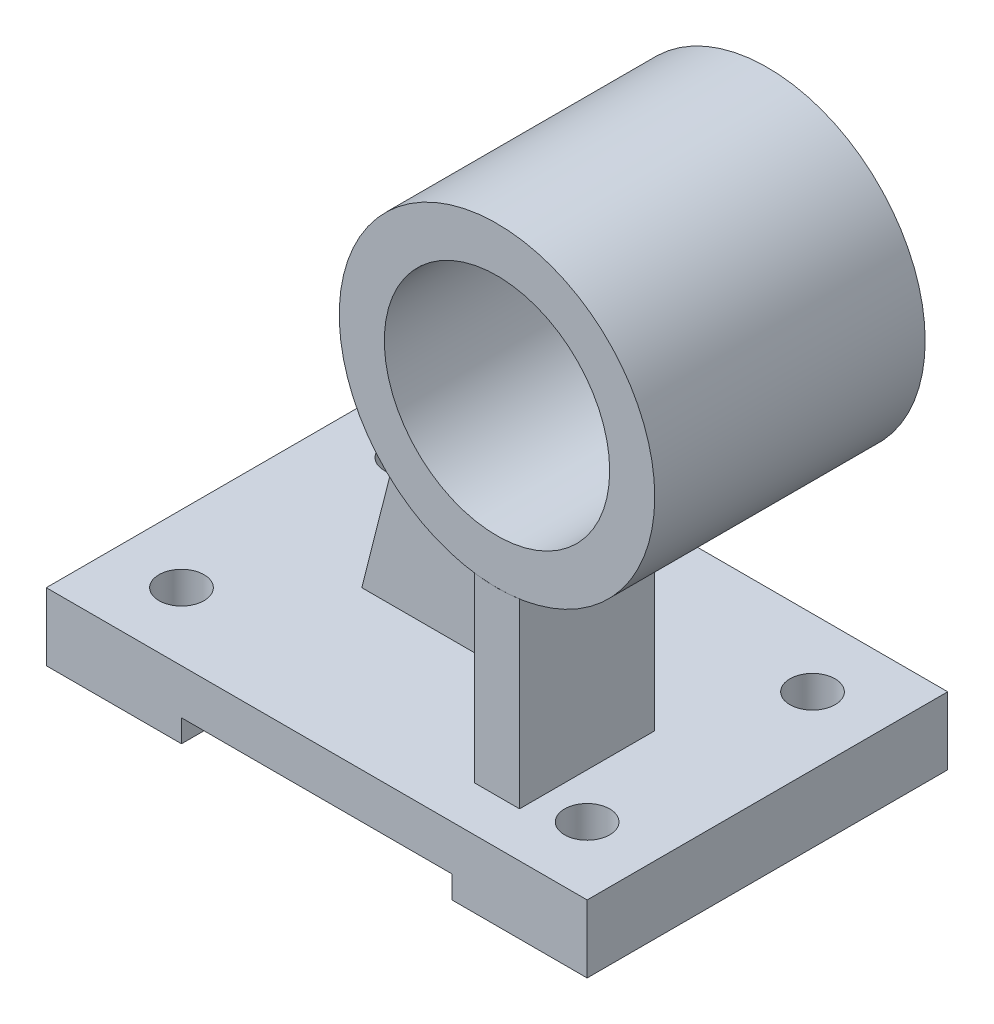
from build123d import *

# Parameters (mm, degrees)
SKETCH3_R           = 35
SKETCH3_R_2         = 25
BOSS_EXTRUDE1_DEPTH = 30
BOSS_EXTRUDE2_DEPTH = 30
BOSS_EXTRUDE3_DEPTH = 40
BOSS_EXTRUDE4_DEPTH = 5
SKETCH9_R           = 5
CUT_EXTRUDE1_DEPTH  = 148.62165212


with BuildPart() as part:
    # Sketch3 → Boss-Extrude1 (new, symmetric)
    with BuildSketch(Plane.XY):
        Circle(SKETCH3_R)
        Circle(SKETCH3_R_2, mode=Mode.SUBTRACT)
    extrude(amount=BOSS_EXTRUDE1_DEPTH, both=True)


with BuildPart() as body_2:
    # Sketch4 → Boss-Extrude2 (new body)
    with BuildSketch(Plane.XY.offset(30)):
        with BuildLine():
            Line((0, -74.96432228), (0, -35))
            ThreePointArc((0, -35), (-2.506435188, -34.91013868), (-5, -34.641016151))
            Line((-5, -34.641016151), (-5, -74.96432228))
            Line((-5, -74.96432228), (0, -74.96432228))
        make_face()
        with BuildLine():
            ThreePointArc((5, -34.641016151), (2.506435188, -34.91013868), (0, -35))
            Line((0, -35), (0, -74.96432228))
            Line((0, -74.96432228), (5, -74.96432228))
            Line((5, -74.96432228), (5, -34.641016151))
        make_face()
    extrude(amount=-BOSS_EXTRUDE2_DEPTH)

    # Sketch5 → Boss-Extrude3 (add, symmetric)
    with BuildSketch(Plane.XY):
        Polygon((0, -74.96432228), (30, -74.96432228), (30, -89.96432228), (0, -89.96432228), (0, -84.96432228), (-60, -84.96432228), (-60, -89.96432228), (-90, -89.96432228), (-90, -74.96432228), align=None)
    extrude(amount=BOSS_EXTRUDE3_DEPTH, both=True)

    # Sketch9 → Cut-Extrude1 (cut, through all)
    with BuildSketch(Plane(origin=(0, -74.96432228, 0), x_dir=(1, 0, 0), z_dir=(0, 1, 0))):
        with Locations(Location((-75, 25, 0), (0, 0, 270))):
            Circle(SKETCH9_R)
        with Locations(Location((-75, -25, 0), (0, 0, 270))):
            Circle(SKETCH9_R)
        with Locations(Location((15, -25, 0), (0, 0, 90))):
            Circle(SKETCH9_R)
        with Locations(Location((15, 25, 0), (0, 0, 90))):
            Circle(SKETCH9_R)
    extrude(amount=-CUT_EXTRUDE1_DEPTH, mode=Mode.SUBTRACT)


with BuildPart() as body_3:
    # Sketch6 → Boss-Extrude4 (new, symmetric)
    with BuildSketch(Plane.XY):
        with BuildLine():
            Line((-5, -34.641016151), (-5, -74.96432228))
            Line((-5, -74.96432228), (-55, -74.96432228))
            Line((-55, -74.96432228), (-34.488570409, 5.96141855))
            ThreePointArc((-34.488570409, 5.96141855), (-28.319184737, -20.567541804), (-5, -34.641016151))
        make_face()
    extrude(amount=BOSS_EXTRUDE4_DEPTH, both=True)


solid = Compound([part.part, body_2.part, body_3.part])
